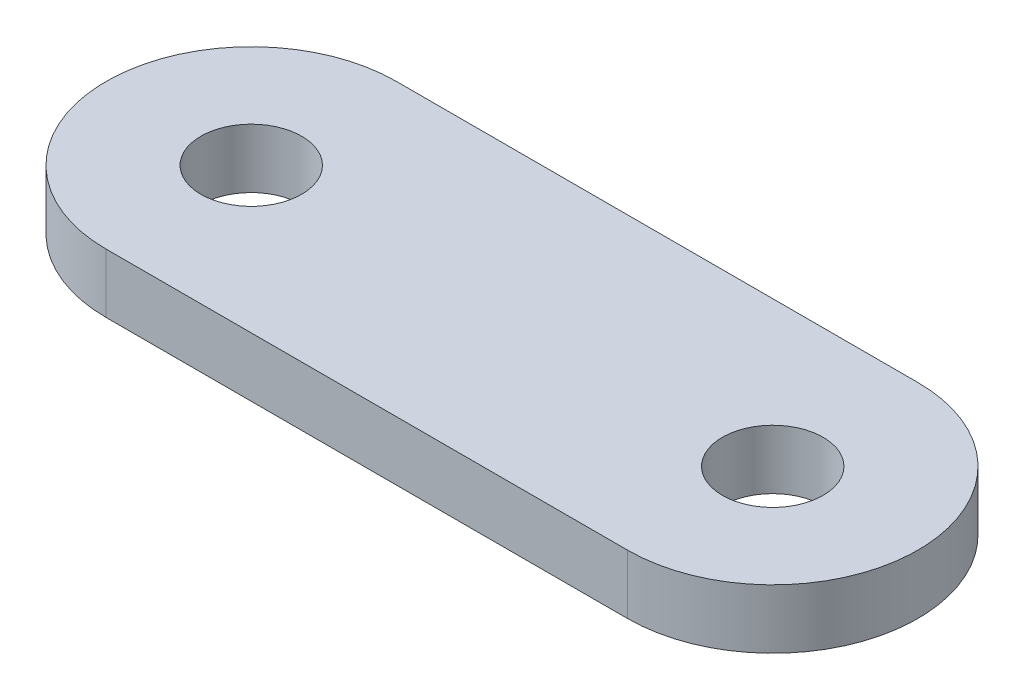
from build123d import *

# Parameters (mm, degrees)
SKETCH1_R           = 1.7
BOSS_EXTRUDE1_DEPTH = 2


with BuildPart() as part:
    # Sketch1 → Boss-Extrude1 (new body)
    with BuildSketch(Plane(origin=(0, 0, 0), x_dir=(1, 0, 0), z_dir=(0, 1, 0))):
        with BuildLine():
            Line((0, 4.9), (17.6, 4.9))
            ThreePointArc((17.6, 4.9), (22.5, 0), (17.6, -4.9))
            Line((17.6, -4.9), (0, -4.9))
            ThreePointArc((0, -4.9), (-4.9, 0), (0, 4.9))
        make_face()
        with Locations(Location((0, 0, 0), (0, 0, 270))):
            Circle(SKETCH1_R, mode=Mode.SUBTRACT)
        with Locations(Location((17.6, 0, 0), (0, 0, 270))):
            Circle(SKETCH1_R, mode=Mode.SUBTRACT)
    extrude(amount=BOSS_EXTRUDE1_DEPTH)


solid = part.part
